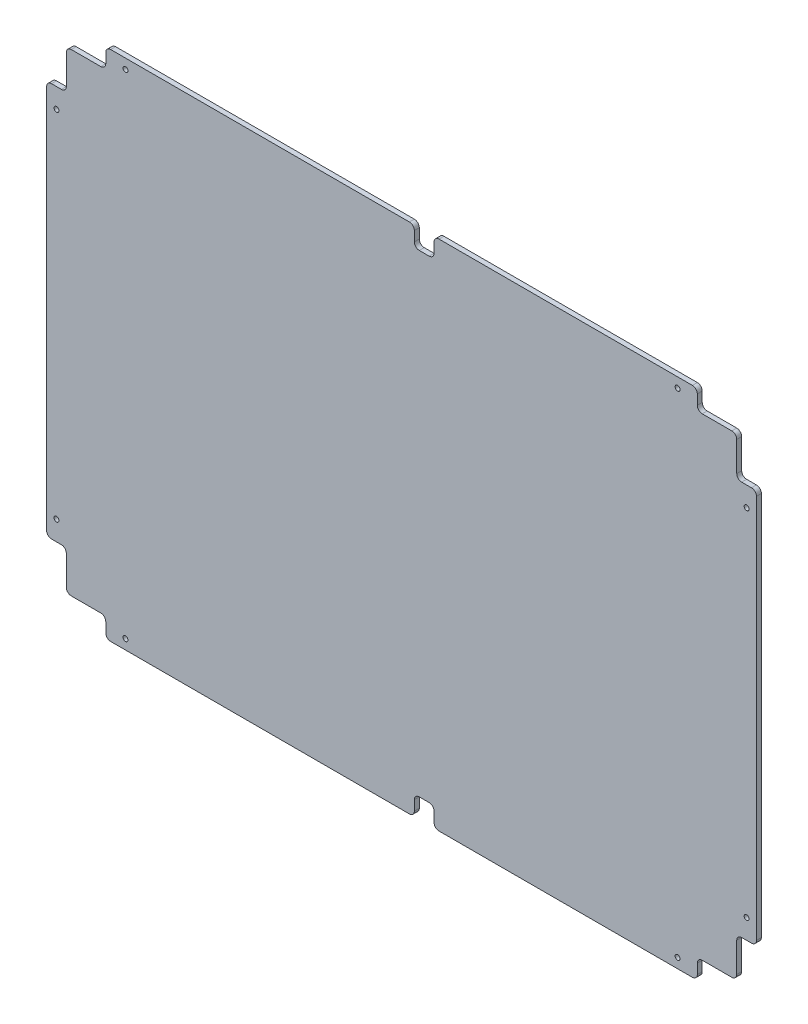
from build123d import *

# Parameters (mm, degrees)
SKETCH_1_W          = 720
SKETCH_1_H          = 520
EXTRUDE_1_DEPTH     = 5
CUT_EXTRUDE_1_DEPTH = 445.100213916
SKETCH_3_R          = 2.5
CUT_EXTRUDE_2_DEPTH = 445.100213916
SKETCH_4_W          = 20
SKETCH_4_H          = 20
CUT_EXTRUDE_3_DEPTH = 10
FILLET_1_R          = 5


with BuildPart() as part:
    # 草图1 → 凸台-拉伸1 (new body)
    with BuildSketch(Plane.XY):
        Rectangle(SKETCH_1_W, SKETCH_1_H)
    extrude(amount=EXTRUDE_1_DEPTH)

    # 草图2 → 切除-拉伸1 (cut, through all)
    with BuildSketch(Plane.XY.offset(5)):
        Polygon((340, -240), (340, -200), (360, -200), (360, -260), (300, -260), (300, -240), align=None)
        Polygon((340, 240), (300, 240), (300, 260), (360, 260), (360, 200), (340, 200), align=None)
        Polygon((-340, 240), (-340, 200), (-360, 200), (-360, 260), (-300, 260), (-300, 240), align=None)
        Polygon((-340, -240), (-300, -240), (-300, -260), (-360, -260), (-360, -200), (-340, -200), align=None)
    extrude(amount=-CUT_EXTRUDE_1_DEPTH, mode=Mode.SUBTRACT)

    # 草图3 → 切除-拉伸2 (cut, through all)
    with BuildSketch(Plane.XY.offset(5)):
        with Locations((350, 180)):
            Circle(SKETCH_3_R)
        with Locations((280, 250)):
            Circle(SKETCH_3_R)
        with Locations((-280, 250)):
            Circle(SKETCH_3_R)
        with Locations((-350, 180)):
            Circle(SKETCH_3_R)
        with Locations((-350, -180)):
            Circle(SKETCH_3_R)
        with Locations((-280, -250)):
            Circle(SKETCH_3_R)
        with Locations((350, -180)):
            Circle(SKETCH_3_R)
        with Locations((280, -250)):
            Circle(SKETCH_3_R)
    extrude(amount=-CUT_EXTRUDE_2_DEPTH, mode=Mode.SUBTRACT)

    # 草图4 → 切除-拉伸3 (cut)
    with BuildSketch(Plane.XY.offset(5)):
        with Locations((23, 250)):
            Rectangle(SKETCH_4_W, SKETCH_4_H)
    cut_extrude_3 = extrude(amount=-CUT_EXTRUDE_3_DEPTH, mode=Mode.SUBTRACT)

    # 镜向2: 切除-拉伸3 across plane
    add(cut_extrude_3.mirror(Plane.ZX), mode=Mode.SUBTRACT)

    # 圆角1
    fillet_1_edges = [part.edges().sort_by_distance(p)[0] for p in [
        (13, 260, 2.5),
        (33, 260, 2.5),
        (33, 240, 2.5),
        (13, 240, 2.5),
        (33, -260, 2.5),
        (13, -260, 2.5),
        (13, -240, 2.5),
        (33, -240, 2.5),
        (-360, -200, 2.5),
        (-340, -200, 2.5),
        (-340, -240, 2.5),
        (-300, -240, 2.5),
        (-300, -260, 2.5),
        (-300, 260, 2.5),
        (-300, 240, 2.5),
        (-340, 240, 2.5),
        (-340, 200, 2.5),
        (-360, 200, 2.5),
        (360, 200, 2.5),
        (340, 200, 2.5),
        (340, 240, 2.5),
        (300, 240, 2.5),
        (300, 260, 2.5),
        (300, -260, 2.5),
        (300, -240, 2.5),
        (340, -240, 2.5),
        (340, -200, 2.5),
        (360, -200, 2.5),
    ]]
    fillet(fillet_1_edges, radius=FILLET_1_R)


solid = part.part
